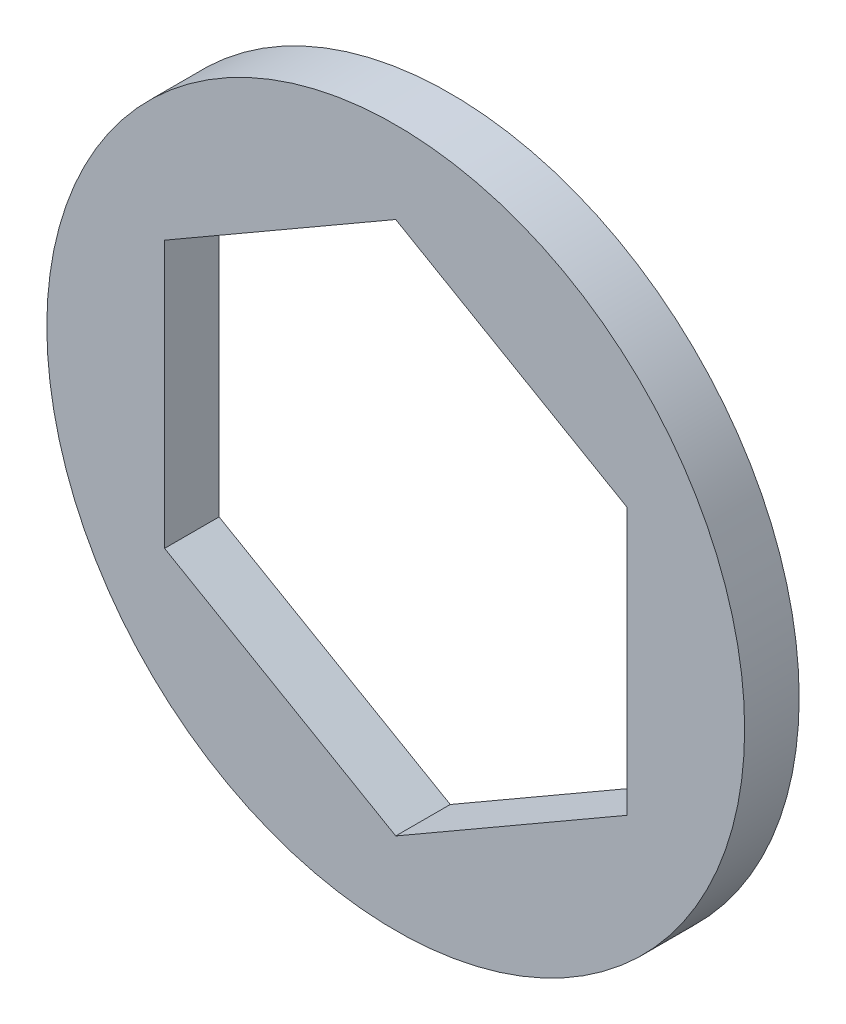
from build123d import *

# Parameters (mm, degrees)
SKETCH1_R           = 10.16
BOSS_EXTRUDE1_DEPTH = 1.5875


with BuildPart() as part:
    # Sketch1 → Boss-Extrude1 (new body)
    with BuildSketch(Plane.XY):
        Circle(SKETCH1_R)
        Polygon((6.731, 3.886144662), (0, 7.772289324), (-6.731, 3.886144662), (-6.731, -3.886144662), (0, -7.772289324), (6.731, -3.886144662), align=None, mode=Mode.SUBTRACT)
    extrude(amount=BOSS_EXTRUDE1_DEPTH)


solid = part.part
